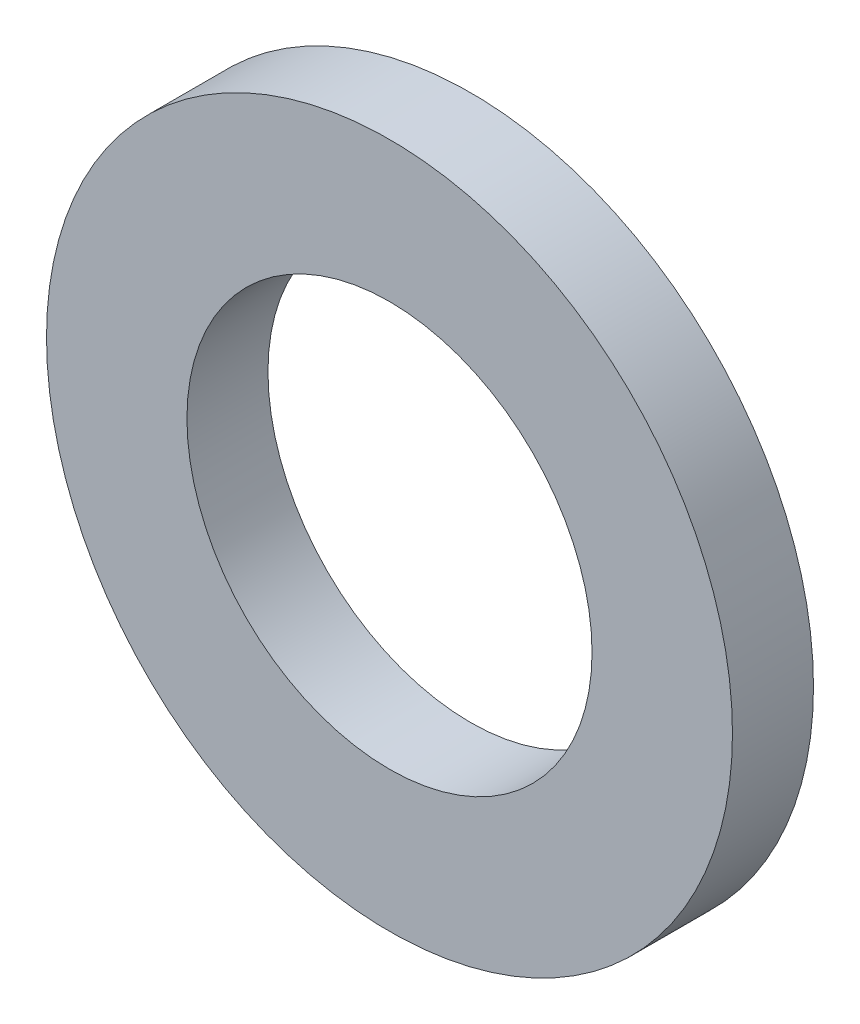
from build123d import *

# Parameters (mm, degrees)
SKETCH_1_R      = 101.6
SKETCH_1_R_2    = 60
EXTRUDE_1_DEPTH = 24


with BuildPart() as part:
    # 草图1 → 凸台-拉伸1 (new body)
    with BuildSketch(Plane.XY):
        Circle(SKETCH_1_R)
        Circle(SKETCH_1_R_2, mode=Mode.SUBTRACT)
    extrude(amount=EXTRUDE_1_DEPTH)


solid = part.part
